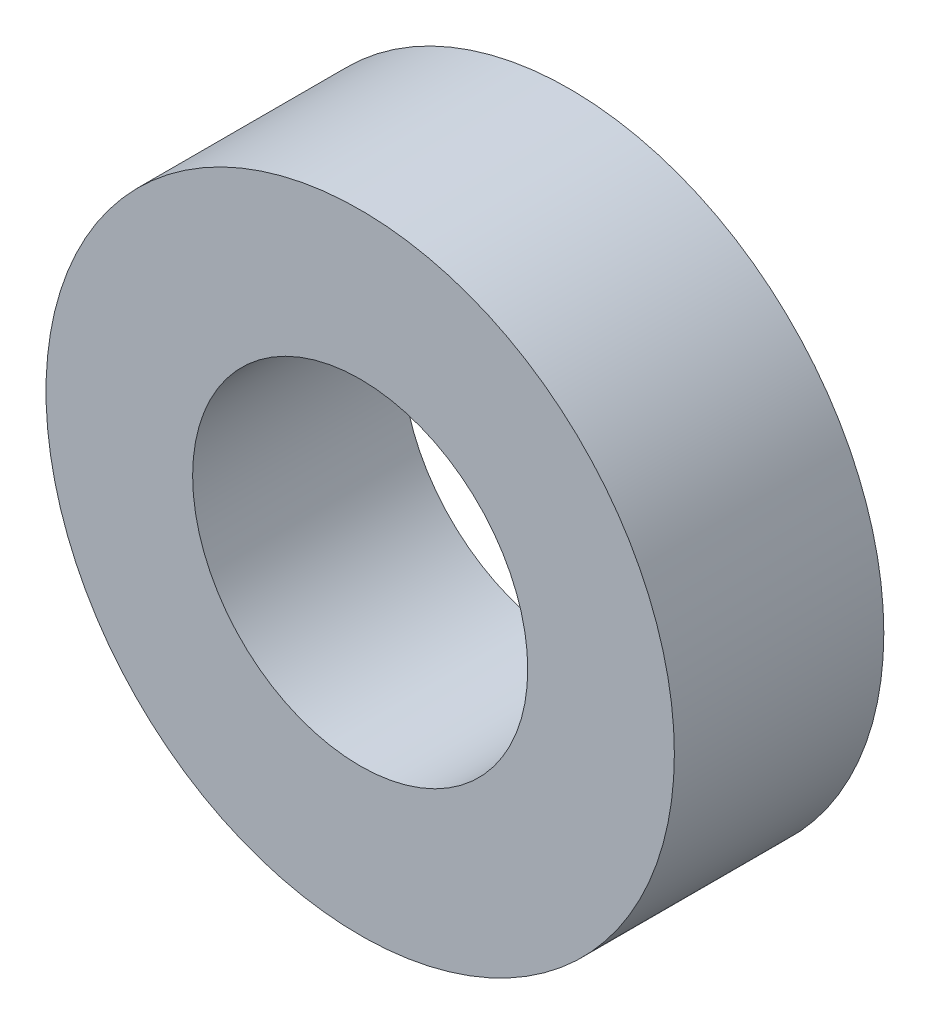
from build123d import *

# Parameters (mm, degrees)
SKETCH1_R           = 7.5
SKETCH1_R_2         = 4
BOSS_EXTRUDE1_DEPTH = 5


with BuildPart() as part:
    # Sketch1 → Boss-Extrude1 (new body)
    with BuildSketch(Plane.XY):
        Circle(SKETCH1_R)
        Circle(SKETCH1_R_2, mode=Mode.SUBTRACT)
    extrude(amount=BOSS_EXTRUDE1_DEPTH)


solid = part.part
